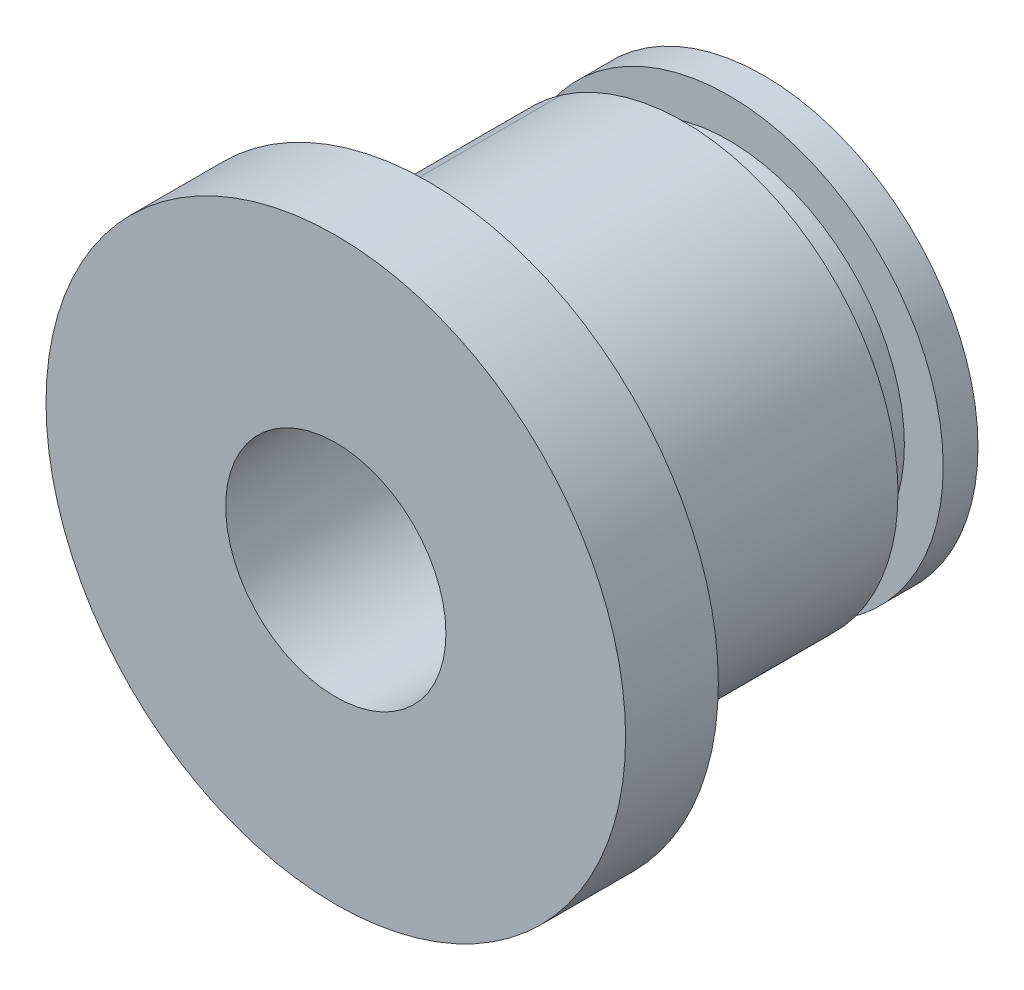
from build123d import *

# Parameters (mm, degrees)
SKETCH1_R           = 6.35
BOSS_EXTRUDE1_DEPTH = 2.032
SKETCH2_R           = 4.699
BOSS_EXTRUDE2_DEPTH = 7.3406
SKETCH4_W           = 0.9906
SKETCH4_H           = 0.8509
SKETCH8_R           = 2.413
CUT_EXTRUDE2_DEPTH  = 15.24


with BuildPart() as part:
    # Sketch1 → Boss-Extrude1 (new body)
    with BuildSketch(Plane.XY):
        Circle(SKETCH1_R)
    extrude(amount=BOSS_EXTRUDE1_DEPTH)

    # Sketch2 → Boss-Extrude2 (add)
    with BuildSketch(Plane(origin=(0, 0, 0), x_dir=(-1, 0, 0), z_dir=(0, 0, -1))):
        Circle(SKETCH2_R)
    extrude(amount=BOSS_EXTRUDE2_DEPTH)

    # Sketch4 → Cut-Revolve1 (revolve, cut)
    with BuildSketch(Plane(origin=(0, 0, 0), x_dir=(0, 0, -1), z_dir=(1, 0, 0)), mode=Mode.PRIVATE) as cut_revolve1_sk:
        with Locations((6.0833, 4.27355)):
            Rectangle(SKETCH4_W, SKETCH4_H)
    revolve(cut_revolve1_sk.sketch.rotate(Axis((0, 0, 6.549062663), (0, 0, -1)), 90), axis=Axis((0, 0, 6.549062663), (0, 0, -1)), mode=Mode.SUBTRACT)

    # Sketch8 → Cut-Extrude2 (cut)
    with BuildSketch(Plane.XY.offset(2.032)):
        Circle(SKETCH8_R)
    extrude(amount=-CUT_EXTRUDE2_DEPTH, mode=Mode.SUBTRACT)


solid = part.part
